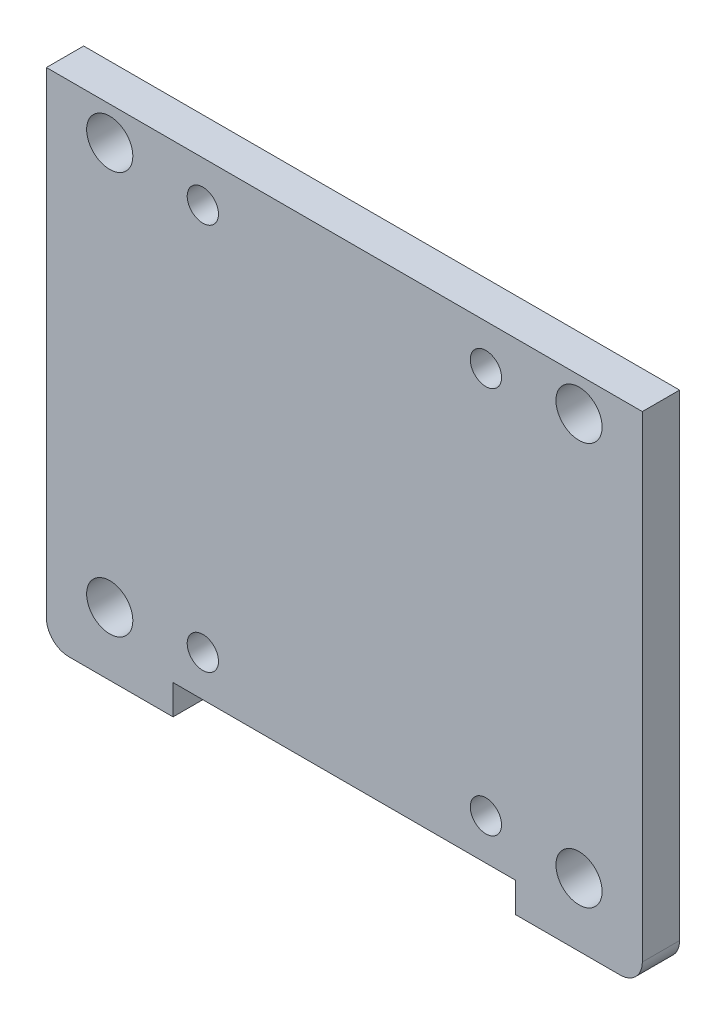
from build123d import *

# Parameters (mm, degrees)
EXTRUDE_1_DEPTH     = 5
SKETCH_2_R          = 3.1
CUT_EXTRUDE_1_DEPTH = 5
SKETCH_3_W          = 46
SKETCH_3_H          = 8
SKETCH_3_W_2        = 80
CUT_EXTRUDE_2_DEPTH = 5
SKETCH_4_R          = 2.1
CUT_EXTRUDE_3_DEPTH = 54.714523176


with BuildPart() as part:
    # 草图1 → 凸台-拉伸1 (new body)
    with BuildSketch(Plane.XY):
        with BuildLine():
            Line((-37, -35.5), (37, -35.5))
            ThreePointArc((37, -35.5), (39.121320344, -34.621320344), (40, -32.5))
            Line((40, -32.5), (40, 32.5))
            ThreePointArc((40, 32.5), (39.121320344, 34.621320344), (37, 35.5))
            Line((37, 35.5), (-37, 35.5))
            ThreePointArc((-37, 35.5), (-39.121320344, 34.621320344), (-40, 32.5))
            Line((-40, 32.5), (-40, -32.5))
            ThreePointArc((-40, -32.5), (-39.121320344, -34.621320344), (-37, -35.5))
        make_face()
    extrude(amount=EXTRUDE_1_DEPTH)

    # 草图2 → 切除-拉伸1 (cut)
    with BuildSketch(Plane.XY.offset(5)):
        with Locations((-31.5, 27)):
            Circle(SKETCH_2_R)
        with Locations((31.5, 27)):
            Circle(SKETCH_2_R)
        with Locations((31.5, -27)):
            Circle(SKETCH_2_R)
        with Locations((-31.5, -27)):
            Circle(SKETCH_2_R)
    extrude(amount=-CUT_EXTRUDE_1_DEPTH, mode=Mode.SUBTRACT)

    # 草图3 → 切除-拉伸2 (cut)
    with BuildSketch(Plane.XY.offset(5)):
        with Locations((0, -35.5)):
            Rectangle(SKETCH_3_W, SKETCH_3_H)
        with Locations((0, 35.5)):
            Rectangle(SKETCH_3_W_2, SKETCH_3_H)
    extrude(amount=-CUT_EXTRUDE_2_DEPTH, mode=Mode.SUBTRACT)

    # 草图4 → 切除-拉伸3 (cut, through all)
    with BuildSketch(Plane.XY.offset(5)):
        with Locations((19, -26)):
            Circle(SKETCH_4_R)
        with Locations((-19, -26)):
            Circle(SKETCH_4_R)
        with Locations((-19, 26)):
            Circle(SKETCH_4_R)
        with Locations((19, 26)):
            Circle(SKETCH_4_R)
    extrude(amount=-CUT_EXTRUDE_3_DEPTH, mode=Mode.SUBTRACT)


solid = part.part
